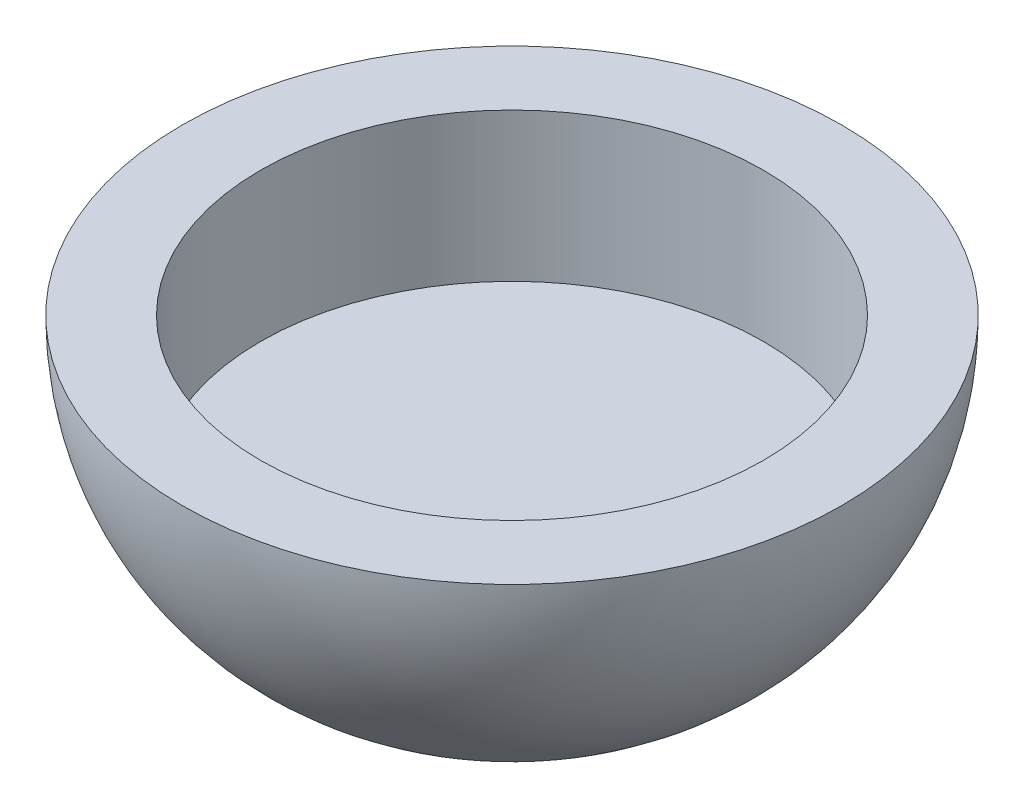
from build123d import *

# Parameters (mm, degrees)
SKETCH2_R          = 7.625
CUT_EXTRUDE1_DEPTH = 4.5


with BuildPart() as part:
    # Sketch1 → Revolve2 (revolve)
    with BuildSketch(Plane.XY, mode=Mode.PRIVATE) as revolve2_sk:
        with BuildLine():
            Line((0, 9), (10, 9))
            ThreePointArc((10, 9), (7.363961031, 2.636038969), (1, 0))
            Line((1, 0), (0, 0))
            Line((0, 0), (0, 9))
        make_face()
    revolve(revolve2_sk.sketch.rotate(Axis((0, 0, 0), (0, 1, 0)), 90), axis=Axis((0, 0, 0), (0, 1, 0)))

    # Sketch2 → Cut-Extrude1 (cut)
    with BuildSketch(Plane(origin=(0, 9, 0), x_dir=(1, 0, 0), z_dir=(0, 1, 0))):
        with Locations(Location((0, 0, 0), (0, 0, 270))):
            Circle(SKETCH2_R)
    extrude(amount=-CUT_EXTRUDE1_DEPTH, mode=Mode.SUBTRACT)


solid = part.part
